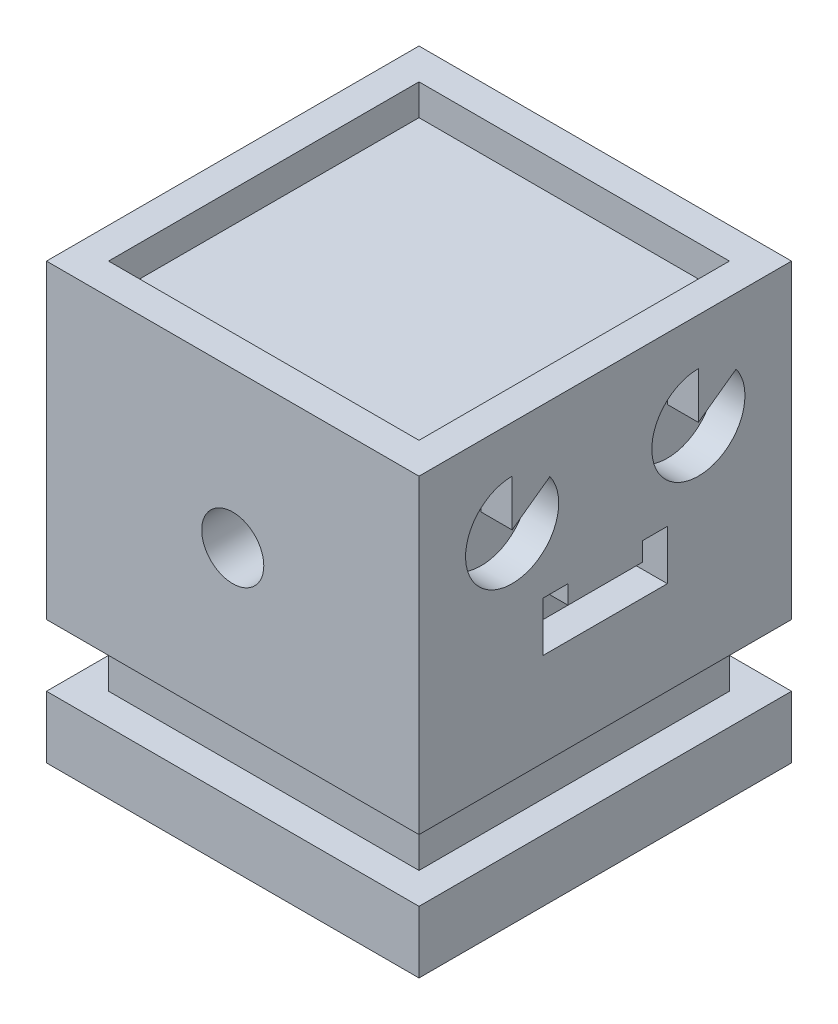
from build123d import *

# Parameters (mm, degrees)
SKETCH1_W           = 60
SKETCH1_H           = 70
BOSS_EXTRUDE3_DEPTH = 60
SKETCH2_W           = 50
SKETCH2_H           = 50
CUT_EXTRUDE1_DEPTH  = 5
SKETCH3_W           = 5
SKETCH3_H           = 10
CUT_EXTRUDE3_DEPTH  = 111
SKETCH6_W           = 5
SKETCH6_H           = 10
CUT_EXTRUDE4_DEPTH  = 111
CUT_EXTRUDE5_DEPTH  = 5
CUT_EXTRUDE7_DEPTH  = 5
SKETCH9_W           = 40
SKETCH9_H           = 40
CUT_EXTRUDE8_DEPTH  = 60
SKETCH10_R          = 5
CUT_EXTRUDE9_DEPTH  = 111


with BuildPart() as part:
    # Sketch1 → Boss-Extrude3 (new body)
    with BuildSketch(Plane.XY):
        with Locations((30, 35)):
            Rectangle(SKETCH1_W, SKETCH1_H)
    extrude(amount=BOSS_EXTRUDE3_DEPTH)

    # Sketch2 → Cut-Extrude1 (cut)
    with BuildSketch(Plane(origin=(0, 70, 0), x_dir=(1, 0, 0), z_dir=(0, 1, 0))):
        with Locations((30, -30)):
            Rectangle(SKETCH2_W, SKETCH2_H)
    extrude(amount=-CUT_EXTRUDE1_DEPTH, mode=Mode.SUBTRACT)

    # Sketch3 → Cut-Extrude3 (cut, through all)
    with BuildSketch(Plane.XY.offset(60)):
        with Locations((2.5, 15)):
            Rectangle(SKETCH3_W, SKETCH3_H)
        with Locations((57.5, 15)):
            Rectangle(SKETCH3_W, SKETCH3_H)
    extrude(amount=-CUT_EXTRUDE3_DEPTH, mode=Mode.SUBTRACT)

    # Sketch6 → Cut-Extrude4 (cut, through all)
    with BuildSketch(Plane(origin=(60, 0, 0), x_dir=(0, 0, -1), z_dir=(1, 0, 0))):
        with Locations((-57.5, 15)):
            Rectangle(SKETCH6_W, SKETCH6_H)
        with Locations((-2.5, 15)):
            Rectangle(SKETCH6_W, SKETCH6_H)
    extrude(amount=-CUT_EXTRUDE4_DEPTH, mode=Mode.SUBTRACT)

    # Sketch7 → Cut-Extrude5 (cut)
    with BuildSketch(Plane(origin=(60, 0, 0), x_dir=(0, 0, -1), z_dir=(1, 0, 0))):
        Polygon((-36, 40), (-24, 40), (-24, 43), (-20, 43), (-20, 40), (-20, 35), (-40, 35), (-40, 40), (-40, 43), (-36, 43), align=None)
    extrude(amount=-CUT_EXTRUDE5_DEPTH, mode=Mode.SUBTRACT)

    # Sketch8 → Cut-Extrude7 (cut)
    with BuildSketch(Plane(origin=(60, 0, 0), x_dir=(0, 0, -1), z_dir=(1, 0, 0))):
        with BuildLine():
            Line((-45, 55), (-45, 62.5))
            ThreePointArc((-45, 62.5), (-48.408526169, 48.319285266), (-38.927629067, 59.401853162))
            Line((-38.927629067, 59.401853162), (-45, 55))
        make_face()
        with BuildLine():
            Line((-15, 55), (-8.927629067, 59.401853162))
            ThreePointArc((-8.927629067, 59.401853162), (-18.408526169, 48.319285266), (-15, 62.5))
            Line((-15, 62.5), (-15, 55))
        make_face()
    extrude(amount=-CUT_EXTRUDE7_DEPTH, mode=Mode.SUBTRACT)

    # Sketch9 → Cut-Extrude8 (cut)
    with BuildSketch(Plane(origin=(0, 0, 0), x_dir=(-1, 0, 0), z_dir=(0, -1, 0))):
        with Locations((-30, -30)):
            Rectangle(SKETCH9_W, SKETCH9_H)
    extrude(amount=-CUT_EXTRUDE8_DEPTH, mode=Mode.SUBTRACT)

    # Sketch10 → Cut-Extrude9 (cut, through all)
    with BuildSketch(Plane.XY.offset(60)):
        with Locations((30, 45)):
            Circle(SKETCH10_R)
    extrude(amount=-CUT_EXTRUDE9_DEPTH, mode=Mode.SUBTRACT)


solid = part.part
